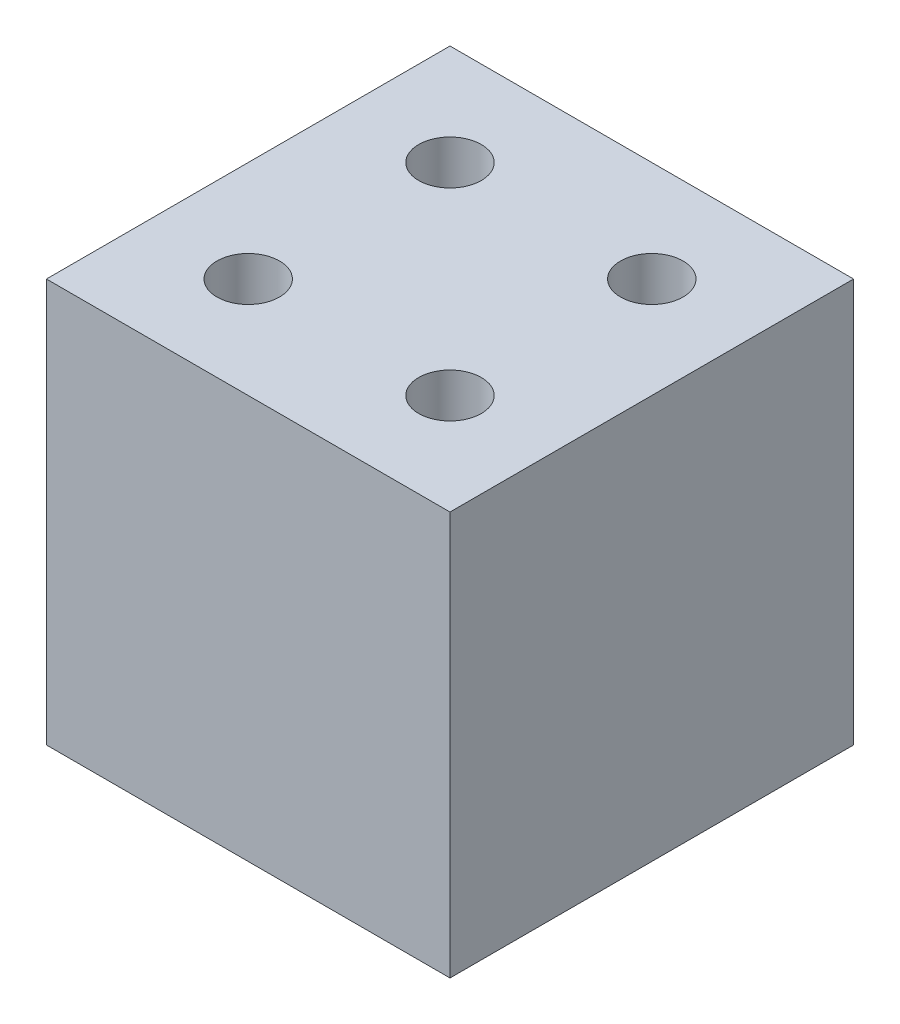
from build123d import *

# Parameters (mm, degrees)
SKETCH_1_W      = 20
SKETCH_1_H      = 20
SKETCH_1_R      = 1.55
EXTRUDE_1_DEPTH = 20


with BuildPart() as part:
    # 草图1 → 凸台-拉伸1 (new body)
    with BuildSketch(Plane(origin=(0, 0, 0), x_dir=(1, 0, 0), z_dir=(0, 1, 0))):
        Rectangle(SKETCH_1_W, SKETCH_1_H)
        with Locations(Location((-5, 5, 0), (0, 0, 270))):
            Circle(SKETCH_1_R, mode=Mode.SUBTRACT)
        with Locations(Location((5, 5, 0), (0, 0, 270))):
            Circle(SKETCH_1_R, mode=Mode.SUBTRACT)
        with Locations(Location((-5, -5, 0), (0, 0, 270))):
            Circle(SKETCH_1_R, mode=Mode.SUBTRACT)
        with Locations(Location((5, -5, 0), (0, 0, 270))):
            Circle(SKETCH_1_R, mode=Mode.SUBTRACT)
    extrude(amount=EXTRUDE_1_DEPTH)


solid = part.part
